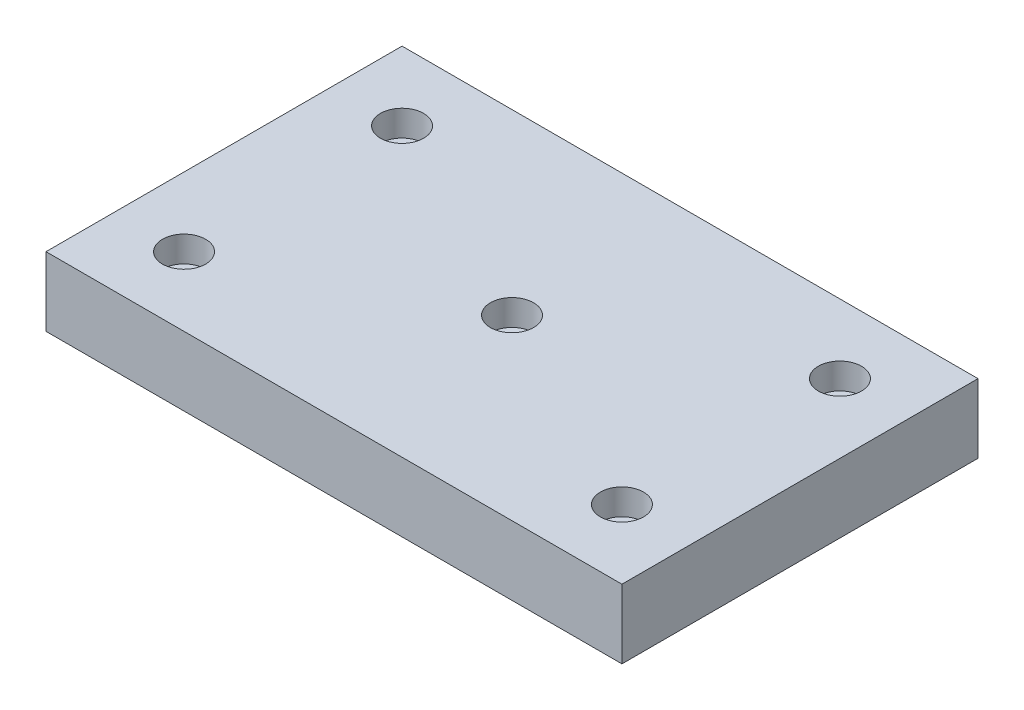
from build123d import *

# Parameters (mm, degrees)
SKETCH1_W                                        = 211.932606224
SKETCH1_H                                        = 131.01903931
BOSS_EXTRUDE1_DEPTH                              = 25.4
CBORE_FOR_3_8_SOCKET_HEAD_CAP_SCREW1_D           = 10.0838
CBORE_FOR_3_8_SOCKET_HEAD_CAP_SCREW1_CBORE_D     = 15.875
CBORE_FOR_3_8_SOCKET_HEAD_CAP_SCREW1_CBORE_DEPTH = 9.525


with BuildPart() as part:
    # Sketch1 → Boss-Extrude1 (new body)
    with BuildSketch(Plane(origin=(0, 0, 0), x_dir=(1, 0, 0), z_dir=(0, 1, 0))):
        Rectangle(SKETCH1_W, SKETCH1_H)
    extrude(amount=BOSS_EXTRUDE1_DEPTH)

    # CBORE for 3/8 Socket Head Cap Screw1 (through all)
    with Locations(Plane(origin=(0, 25.4, 0), x_dir=(1, 0, 0), z_dir=(0, 1, 0))):
        with Locations((-80.566303112, -40.109519655), (-80.566303112, 40.109519655), (80.566303112, 40.109519655), (80.566303112, -40.109519655), (0, 0)):
            CounterBoreHole(CBORE_FOR_3_8_SOCKET_HEAD_CAP_SCREW1_D / 2, CBORE_FOR_3_8_SOCKET_HEAD_CAP_SCREW1_CBORE_D / 2, CBORE_FOR_3_8_SOCKET_HEAD_CAP_SCREW1_CBORE_DEPTH)


solid = part.part
